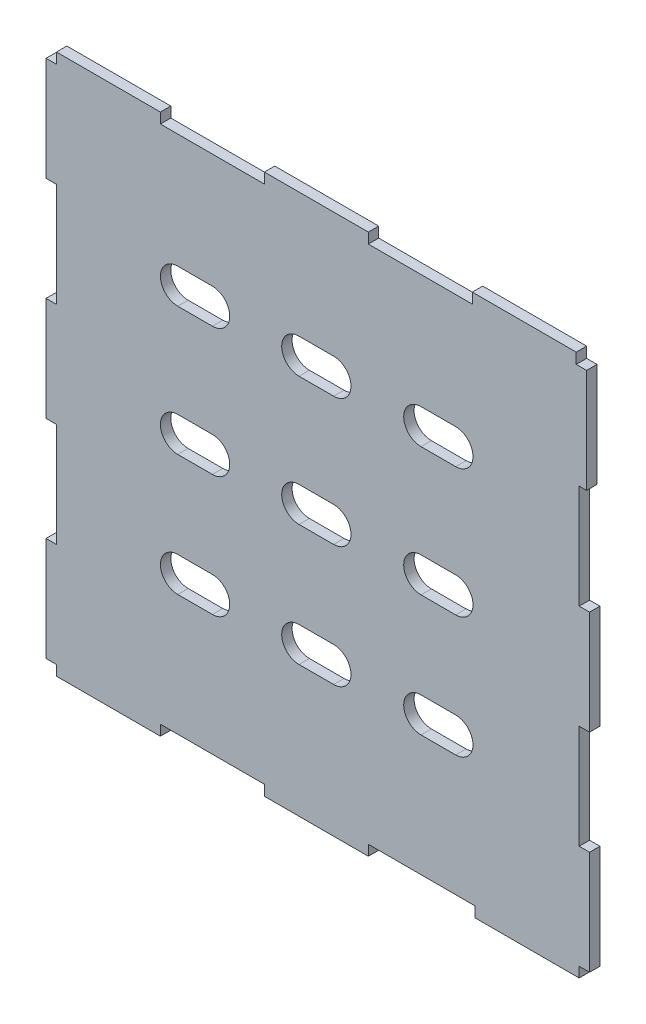
from build123d import *

# Parameters (mm, degrees)
RESSALTO_EXTRUS_O1_DEPTH = 3


with BuildPart() as part:
    # Esboço1 → Ressalto-extrusão1 (new body)
    with BuildSketch(Plane.XY):
        Polygon((-80.141377403, 21.254023913), (-83.141377403, 21.254023913), (-83.141377403, -8.745976087), (-80.141377403, -8.745976087), (-80.141377403, -38.745976087), (-83.141377403, -38.745976087), (-83.141377403, -68.745976087), (-80.141377403, -68.745976087), (-80.141377403, -98.745976087), (-83.141377403, -98.745976087), (-83.141377403, -128.745976087), (-80.141377403, -128.745976087), (-80.141377403, -131.677493187), (-50.141377403, -131.677493187), (-50.141377403, -128.677493187), (-20.141377403, -128.677493187), (-20.141377403, -131.677493187), (9.858622597, -131.677493187), (9.858622597, -128.677493187), (40.700385396, -128.677493187), (40.700385396, -131.677493187), (70.700385396, -131.677493187), (70.700385396, -128.745976087), (73.700385396, -128.745976087), (73.700385396, -98.745976087), (70.700385396, -98.745976087), (70.700385396, -68.745976087), (73.700385396, -68.745976087), (73.700385396, -38.745976087), (70.700385396, -38.745976087), (70.700385396, -8.745976087), (72.858622597, -8.745976087), (72.858622597, 21.254023913), (69.858622597, 21.254023913), (69.858622597, 24.322506813), (39.858622597, 24.322506813), (39.858622597, 21.322506813), (9.858622597, 21.322506813), (9.858622597, 24.322506813), (-20.141377403, 24.322506813), (-20.141377403, 21.322506813), (-50.141377403, 21.322506813), (-50.141377403, 24.322506813), (-80.141377403, 24.322506813), align=None)
        with BuildLine():
            Line((35.066575056, -21.699226817), (25.066575056, -21.699226817))
            ThreePointArc((25.066575056, -21.699226817), (20.066575056, -16.699226817), (25.066575056, -11.699226817))
            Line((25.066575056, -11.699226817), (35.066575056, -11.699226817))
            ThreePointArc((35.066575056, -11.699226817), (40.066575056, -16.699226817), (35.066575056, -21.699226817))
        make_face(mode=Mode.SUBTRACT)
        with BuildLine():
            Line((-0.141377403, -21.699226817), (-10.141377403, -21.699226817))
            ThreePointArc((-10.141377403, -21.699226817), (-15.141377403, -16.699226817), (-10.141377403, -11.699226817))
            Line((-10.141377403, -11.699226817), (-0.141377403, -11.699226817))
            ThreePointArc((-0.141377403, -11.699226817), (4.858622597, -16.699226817), (-0.141377403, -21.699226817))
        make_face(mode=Mode.SUBTRACT)
        with BuildLine():
            Line((-35.141377403, -21.699226817), (-45.141377403, -21.699226817))
            ThreePointArc((-45.141377403, -21.699226817), (-50.141377403, -16.699226817), (-45.141377403, -11.699226817))
            Line((-45.141377403, -11.699226817), (-35.141377403, -11.699226817))
            ThreePointArc((-35.141377403, -11.699226817), (-30.141377403, -16.699226817), (-35.141377403, -21.699226817))
        make_face(mode=Mode.SUBTRACT)
        with BuildLine():
            Line((35.066575056, -58.745976087), (25.066575056, -58.745976087))
            ThreePointArc((25.066575056, -58.745976087), (20.066575056, -53.745976087), (25.066575056, -48.745976087))
            Line((25.066575056, -48.745976087), (35.066575056, -48.745976087))
            ThreePointArc((35.066575056, -48.745976087), (40.066575056, -53.745976087), (35.066575056, -58.745976087))
        make_face(mode=Mode.SUBTRACT)
        with BuildLine():
            Line((-0.141377403, -58.745976087), (-10.141377403, -58.745976087))
            ThreePointArc((-10.141377403, -58.745976087), (-15.141377403, -53.745976087), (-10.141377403, -48.745976087))
            Line((-10.141377403, -48.745976087), (-0.141377403, -48.745976087))
            ThreePointArc((-0.141377403, -48.745976087), (4.858622597, -53.745976087), (-0.141377403, -58.745976087))
        make_face(mode=Mode.SUBTRACT)
        with BuildLine():
            Line((-35.141377403, -58.745976087), (-45.141377403, -58.745976087))
            ThreePointArc((-45.141377403, -58.745976087), (-50.141377403, -53.745976087), (-45.141377403, -48.745976087))
            Line((-45.141377403, -48.745976087), (-35.141377403, -48.745976087))
            ThreePointArc((-35.141377403, -48.745976087), (-30.141377403, -53.745976087), (-35.141377403, -58.745976087))
        make_face(mode=Mode.SUBTRACT)
        with BuildLine():
            Line((35.066575056, -93.745976087), (25.066575056, -93.745976087))
            ThreePointArc((25.066575056, -93.745976087), (20.066575056, -88.745976087), (25.066575056, -83.745976087))
            Line((25.066575056, -83.745976087), (35.066575056, -83.745976087))
            ThreePointArc((35.066575056, -83.745976087), (40.066575056, -88.745976087), (35.066575056, -93.745976087))
        make_face(mode=Mode.SUBTRACT)
        with BuildLine():
            Line((-0.141377403, -93.745976087), (-10.141377403, -93.745976087))
            ThreePointArc((-10.141377403, -93.745976087), (-15.141377403, -88.745976087), (-10.141377403, -83.745976087))
            Line((-10.141377403, -83.745976087), (-0.141377403, -83.745976087))
            ThreePointArc((-0.141377403, -83.745976087), (4.858622597, -88.745976087), (-0.141377403, -93.745976087))
        make_face(mode=Mode.SUBTRACT)
        with BuildLine():
            Line((-35.141377403, -93.745976087), (-45.141377403, -93.745976087))
            ThreePointArc((-45.141377403, -93.745976087), (-50.141377403, -88.745976087), (-45.141377403, -83.745976087))
            Line((-45.141377403, -83.745976087), (-35.141377403, -83.745976087))
            ThreePointArc((-35.141377403, -83.745976087), (-30.141377403, -88.745976087), (-35.141377403, -93.745976087))
        make_face(mode=Mode.SUBTRACT)
    extrude(amount=RESSALTO_EXTRUS_O1_DEPTH)


solid = part.part
